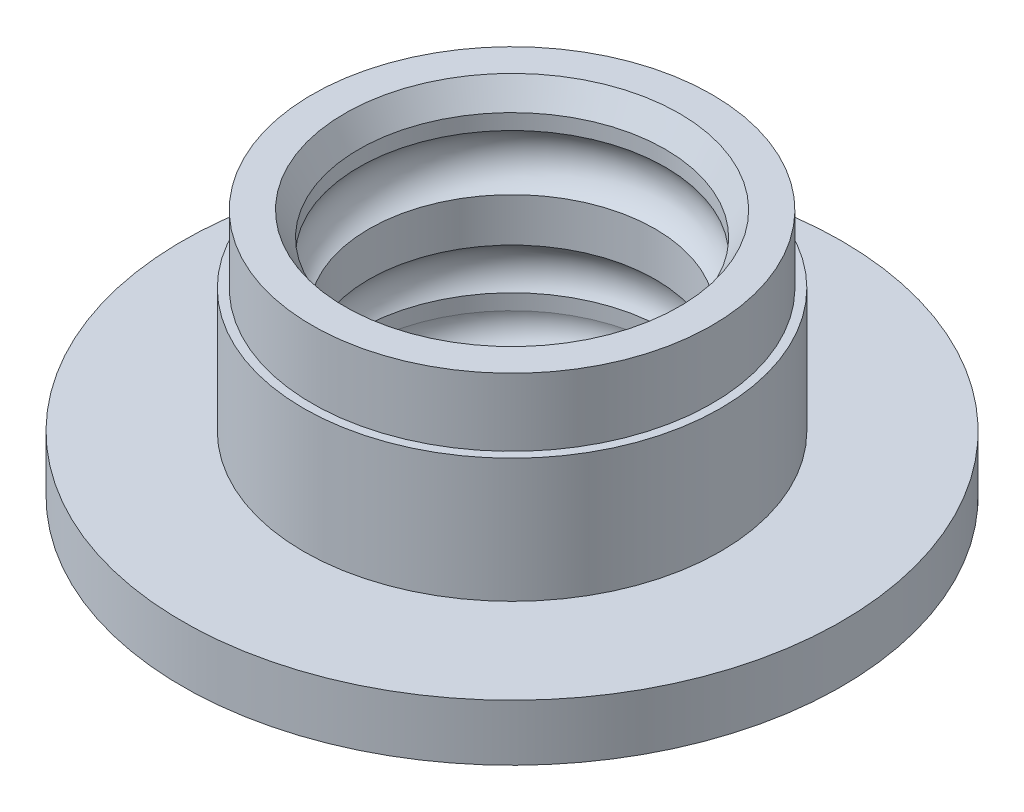
from build123d import *


with BuildPart() as part:
    # Esboço1 → Revolução1 (revolve)
    with BuildSketch(Plane.XY, mode=Mode.PRIVATE) as revolu_o1_sk:
        with BuildLine():
            Line((29.7, 13.740559465), (35.5, 13.740559465))
            Line((35.5, 13.740559465), (35.5, 1.740559465))
            Line((35.5, 1.740559465), (37, 1.740559465))
            Line((37, 1.740559465), (37, -20.259440535))
            Line((37, -20.259440535), (58.5, -20.259440535))
            Line((58.5, -20.259440535), (58.5, -30.259440535))
            Line((58.5, -30.259440535), (29.5, -30.259440535))
            Line((29.5, -30.259440535), (29.5, -35.259440535))
            Line((29.5, -35.259440535), (29, -35.259440535))
            Line((29, -35.259440535), (29, -47.259440535))
            Line((29, -47.259440535), (26, -47.259440535))
            Line((26, -47.259440535), (26, -36.259440535))
            Line((26, -36.259440535), (25.8, -36.259440535))
            Line((25.8, -36.259440535), (25.8, -25.459440535))
            ThreePointArc((25.8, -25.459440535), (27.05755123, -23.383232322), (27.189114949, -20.959440535))
            Line((27.189114949, -20.959440535), (27.189114949, -18.209440535))
            ThreePointArc((27.189114949, -18.209440535), (28.290718341, -13.494165971), (25.4, -9.609440535))
            Line((25.4, -9.609440535), (25.4, -1.859440535))
            ThreePointArc((25.4, -1.859440535), (28.290718341, 2.025284902), (27.189114949, 6.740559465))
            Line((27.189114949, 6.740559465), (27.189114949, 9.490559465))
            Line((27.189114949, 9.490559465), (29.7, 13.740559465))
        make_face()
    revolve(revolu_o1_sk.sketch.rotate(Axis((0, -64.843062606, 0), (0, 1, 0)), 90), axis=Axis((0, -64.843062606, 0), (0, 1, 0)))


solid = part.part
